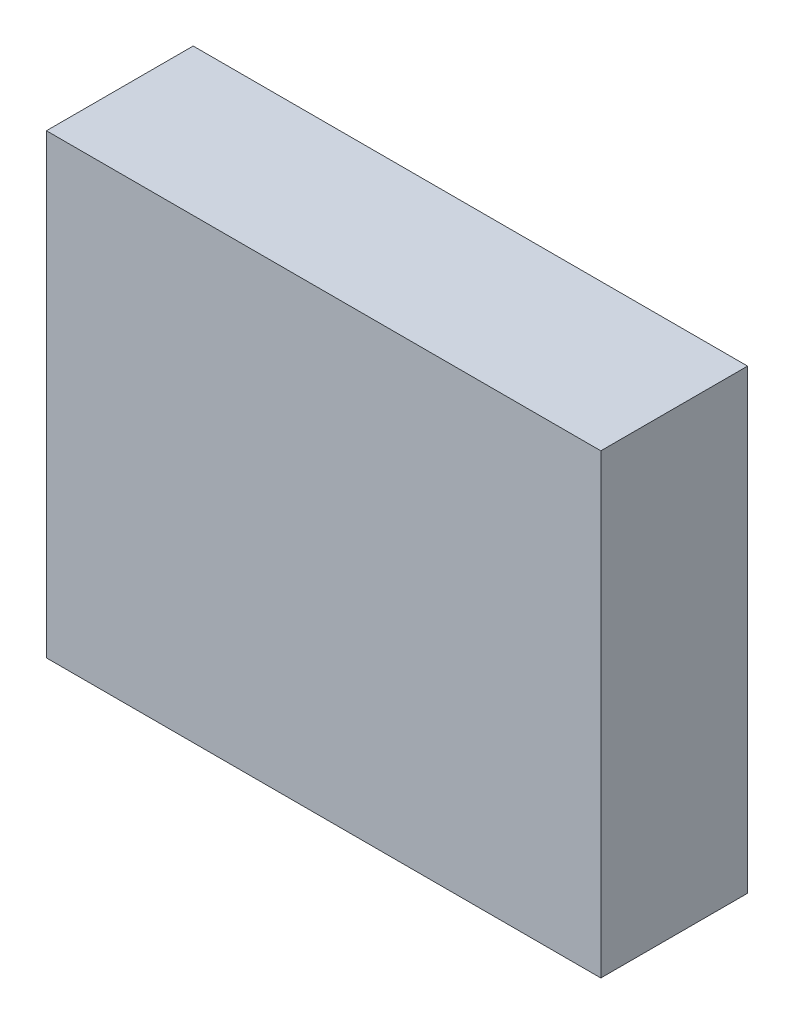
from build123d import *

# Parameters (mm, degrees)
SKETCH1_W           = 215.9
SKETCH1_H           = 177.8
BOSS_EXTRUDE1_DEPTH = 57.15


with BuildPart() as part:
    # Sketch1 → Boss-Extrude1 (new body)
    with BuildSketch(Plane.XY):
        Rectangle(SKETCH1_W, SKETCH1_H)
    extrude(amount=BOSS_EXTRUDE1_DEPTH)


solid = part.part
